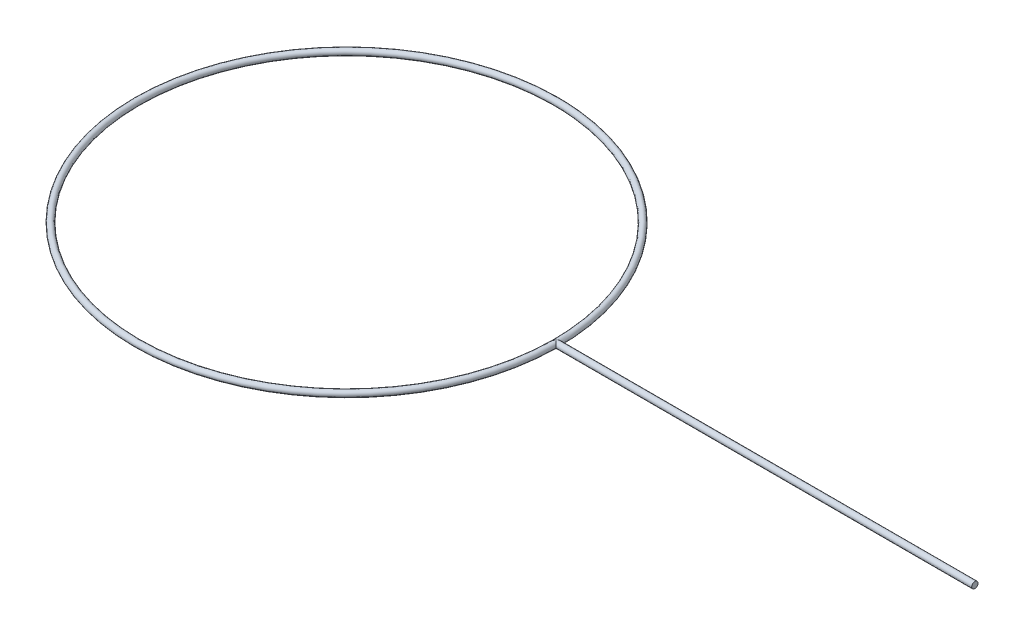
from build123d import *

# Parameters (mm, degrees)
SKETCH_1_R      = 1.5
SKETCH_2_R      = 1.5
EXTRUDE_1_DEPTH = 200


with BuildPart() as part:
    # ｽｹｯﾁ1 → 回転1 (revolve)
    with BuildSketch(Plane.XY, mode=Mode.PRIVATE) as revolve_1_sk:
        Circle(SKETCH_1_R)
    revolve(revolve_1_sk.sketch.rotate(Axis((-100, 40.172248655, 0), (0, -1, 0)), 180), axis=Axis((-100, 40.172248655, 0), (0, -1, 0)))

    # ｽｹｯﾁ2 → ﾎﾞｽ - 押し出し1 (add)
    with BuildSketch(Plane(origin=(0, 0, 0), x_dir=(0, 0, -1), z_dir=(1, 0, 0))):
        with Locations(Location((0, 0, 0), (0, 0, 90))):
            Circle(SKETCH_2_R)
    extrude(amount=EXTRUDE_1_DEPTH)


solid = part.part
